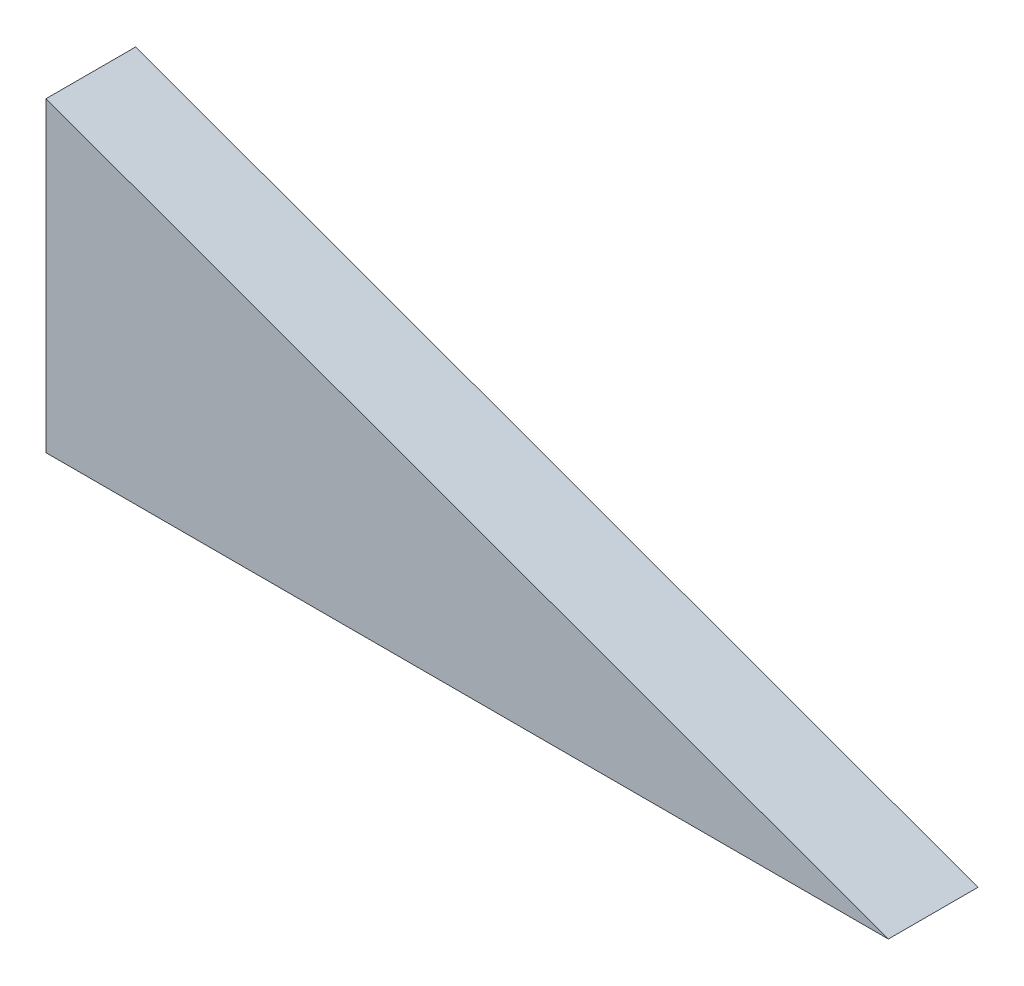
from build123d import *

# Parameters (mm, degrees)
BOSS_EXTRU_1_DEPTH = 5


with BuildPart() as part:
    # Esquisse1 → Boss.-Extru.1 (new body)
    with BuildSketch(Plane.XY):
        Polygon((-101.345686196, -21.029863319), (-54.361055156, -21.029863319), (-101.345686196, -3.928856153), align=None)
    extrude(amount=BOSS_EXTRU_1_DEPTH)


solid = part.part
